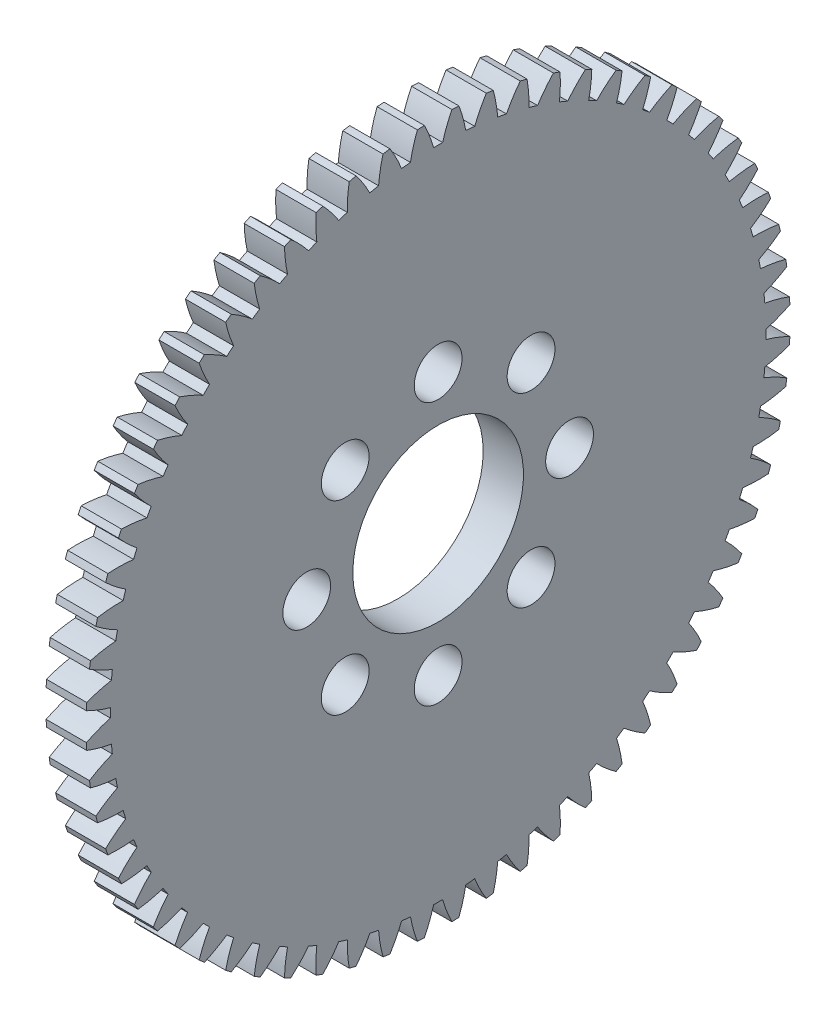
from build123d import *

# Parameters (mm, degrees)
BASPROSKE_W        = 2.9972
BASPROSKE_H        = 26.19375
TOOTHCUT_DEPTH     = 38.164610666
TEETHCUTS_COUNT    = 64
TEETHCUTS_ANGLE    = 354.375
BORSKE_R           = 6.35
BORE_DEPTH         = 50.8000508
SKETCH1_R          = 1.778
CUT_EXTRUDE1_DEPTH = 38.136343191


with BuildPart() as part:
    # BasProSke → Base-Revolve (revolve)
    with BuildSketch(Plane(origin=(0, 0, 0), x_dir=(1, 0, 0), z_dir=(0, 1, 0)), mode=Mode.PRIVATE) as base_revolve_sk:
        with Locations((1.4986, 13.096875)):
            Rectangle(BASPROSKE_W, BASPROSKE_H)
    revolve(base_revolve_sk.sketch.rotate(Axis((-10, 0, 0), (1, 0, 0)), 180), axis=Axis((-10, 0, 0), (1, 0, 0)))

    # TooCutSke → ToothCut (cut, through all)
    with BuildSketch(Plane(origin=(0, 0, 0), x_dir=(0, 0, -1), z_dir=(1, 0, 0))):
        with BuildLine():
            ThreePointArc((0.33374141, 24.394417139), (0, 24.3967), (-0.33374141, 24.394417139))
            ThreePointArc((-0.33374141, 24.394417139), (-0.642437388, 25.31332079), (-1.03730144, 26.19862272))
            ThreePointArc((-1.03730144, 26.19862272), (0, 26.21915), (1.03730144, 26.19862272))
            ThreePointArc((1.03730144, 26.19862272), (0.642437388, 25.31332079), (0.33374141, 24.394417139))
        make_face()
    toothcut = extrude(amount=TOOTHCUT_DEPTH, mode=Mode.SUBTRACT)

    # TeethCuts: ToothCut ×64 about axis
    teethcuts_axis = Axis((-10, 0, 0), (1, 0, 0))
    for i in range(1, TEETHCUTS_COUNT):
        add(toothcut.rotate(teethcuts_axis, i * TEETHCUTS_ANGLE / (TEETHCUTS_COUNT - 1)), mode=Mode.SUBTRACT)

    # BorSke → Bore (cut, symmetric)
    with BuildSketch(Plane(origin=(0, 0, 0), x_dir=(0, 0, -1), z_dir=(1, 0, 0))):
        with Locations(Location((0, 0, 0), (0, 0, 180))):
            Circle(BORSKE_R)
    extrude(amount=BORE_DEPTH, both=True, mode=Mode.SUBTRACT)

    # Sketch1 → Cut-Extrude1 (cut, through all)
    with BuildSketch(Plane(origin=(2.9972, 0, 0), x_dir=(0, 0, -1), z_dir=(1, 0, 0))):
        with Locations((0, 9.779)):
            Circle(SKETCH1_R)
        with Locations((6.914797213, 6.914797213)):
            Circle(SKETCH1_R)
        with Locations((9.779, 0)):
            Circle(SKETCH1_R)
        with Locations((6.914797213, -6.914797213)):
            Circle(SKETCH1_R)
        with Locations((0, -9.779)):
            Circle(SKETCH1_R)
        with Locations((-6.914797213, -6.914797213)):
            Circle(SKETCH1_R)
        with Locations((-9.779, 0)):
            Circle(SKETCH1_R)
        with Locations((-6.914797213, 6.914797213)):
            Circle(SKETCH1_R)
    extrude(amount=-CUT_EXTRUDE1_DEPTH, mode=Mode.SUBTRACT)


solid = part.part
